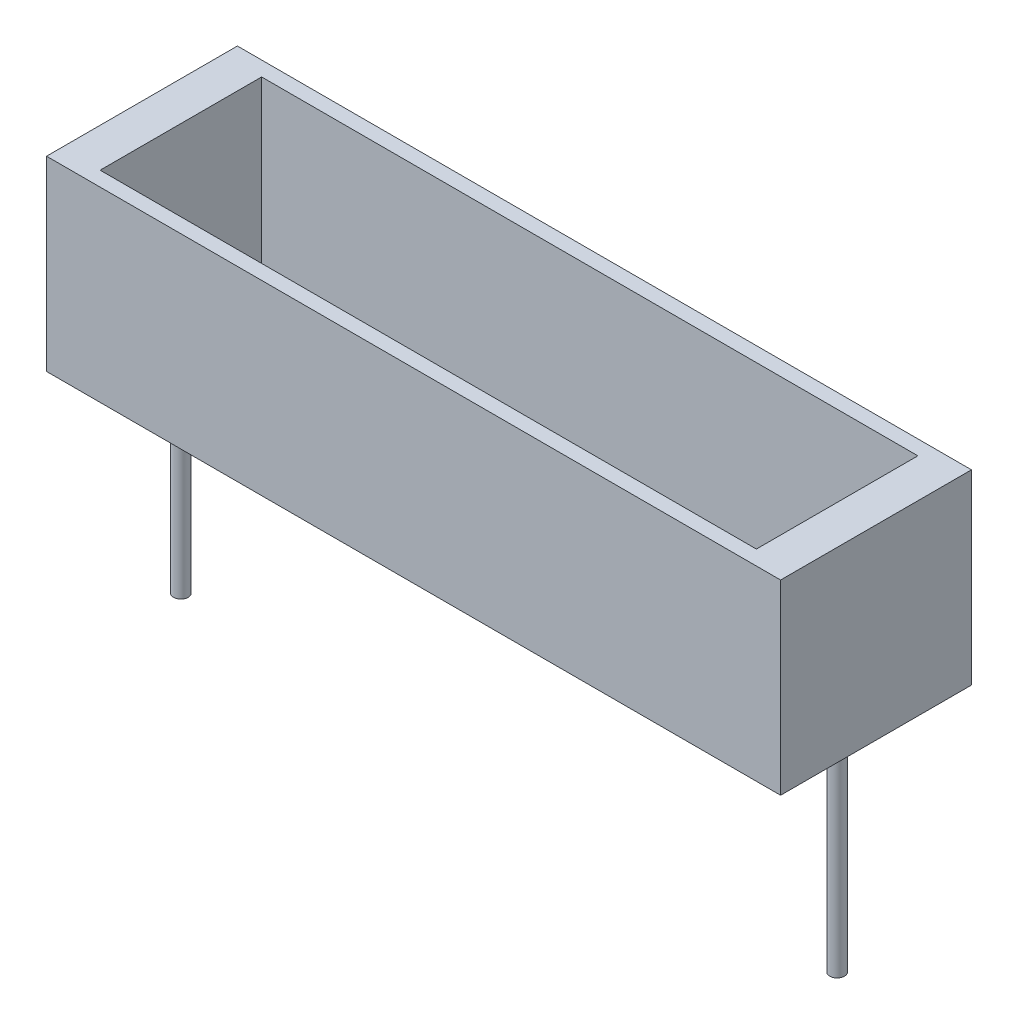
from build123d import *

# Parameters (mm, degrees)
SKETCH1_W          = 50
SKETCH1_H          = 13
EXTRUDE1_DEPTH     = 12.7
SKETCH2_W          = 44.7
SKETCH2_H          = 11
CUT_EXTRUDE1_DEPTH = 11
SKETCH3_R          = 0.5
EXTRUDE2_DEPTH     = 15


with BuildPart() as part:
    # Sketch1 → Extrude1 (new body)
    with BuildSketch(Plane(origin=(0, 0, 0), x_dir=(1, 0, 0), z_dir=(0, 1, 0))):
        Rectangle(SKETCH1_W, SKETCH1_H)
    extrude(amount=EXTRUDE1_DEPTH)

    # Sketch2 → Cut-Extrude1 (cut)
    with BuildSketch(Plane(origin=(0, 12.7, 0), x_dir=(-1, 0, 0), z_dir=(0, 1, 0))):
        Rectangle(SKETCH2_W, SKETCH2_H)
    extrude(amount=-CUT_EXTRUDE1_DEPTH, mode=Mode.SUBTRACT)

    # Sketch3 → Extrude2 (add)
    with BuildSketch(Plane.XZ):
        with Locations((-22.35, 0)):
            Circle(SKETCH3_R)
        with Locations((22.35, 0)):
            Circle(SKETCH3_R)
    extrude(amount=EXTRUDE2_DEPTH)


solid = part.part
